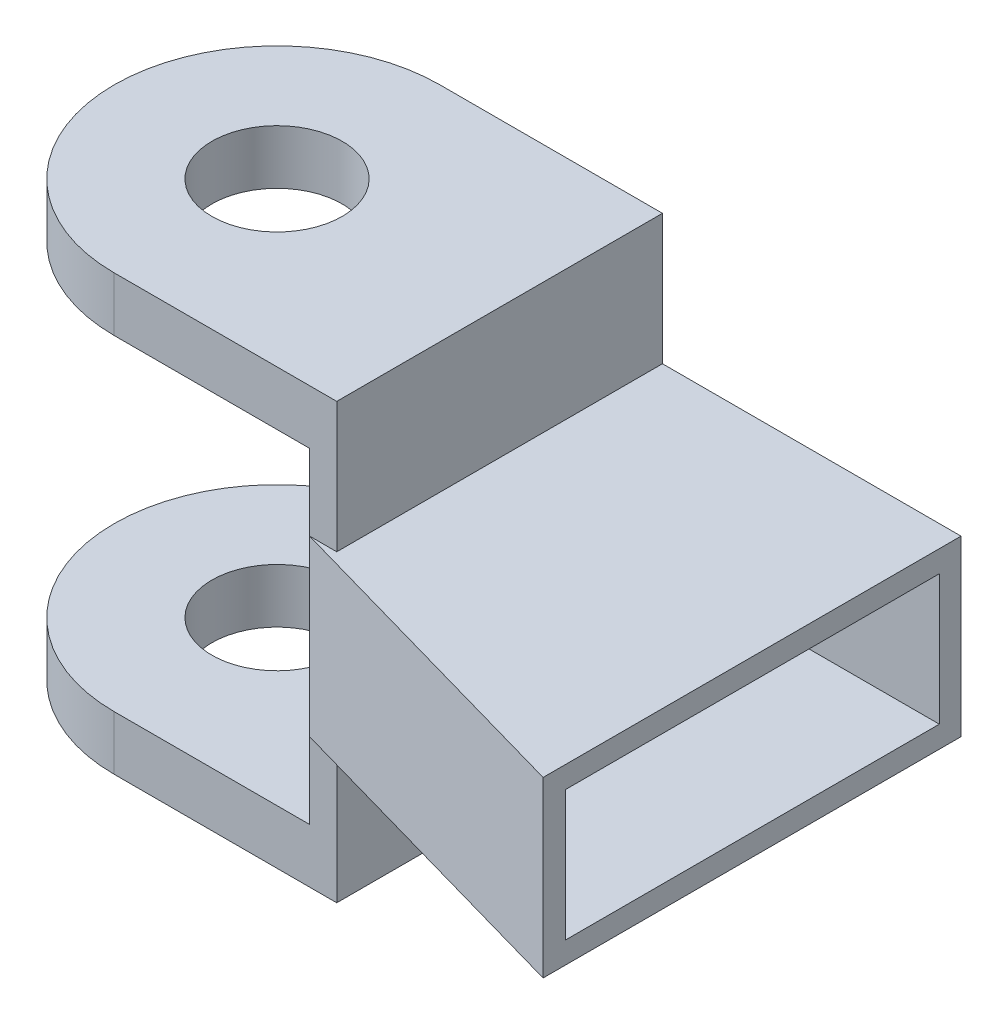
from build123d import *

# Parameters (mm, degrees)
BOSS_EXTRUDE1_DEPTH = 16
SHELL1_T            = -2
SKETCH2_R           = 6
BOSS_EXTRUDE2_DEPTH = 5
SKETCH4_W           = 30
SKETCH4_H           = 12
BOSS_EXTRUDE3_DEPTH = 2.5
SKETCH5_R           = 6
BOSS_EXTRUDE4_DEPTH = 5


with BuildPart() as part:
    # Sketch1 → Boss-Extrude1 (new body)
    with BuildSketch(Plane(origin=(0, 0, 0), x_dir=(1, 0, 0), z_dir=(0, 1, 0))):
        Polygon((-350, 31.008229654), (-320, 22.514402641), (-320, 61.008229654), (-350, 61.008229654), align=None)
    extrude(amount=BOSS_EXTRUDE1_DEPTH)

    # Shell1
    shell1_openings = [part.faces().sort_by_distance(p)[0] for p in [
        (-320, 8, -41.761316148),
    ]]
    offset(amount=SHELL1_T, openings=shell1_openings, kind=Kind.INTERSECTION)



with BuildPart() as body_2:
    # Sketch2 → Boss-Extrude2 (new body)
    with BuildSketch(Plane(origin=(0, 23, 0), x_dir=(1, 0, 0), z_dir=(0, 1, 0))):
        with BuildLine():
            Line((-350, 61.008229654), (-368, 61.008229654))
            ThreePointArc((-368, 61.008229654), (-383, 46.008229654), (-368, 31.008229654))
            Line((-368, 31.008229654), (-350, 31.008229654))
            Line((-350, 31.008229654), (-350, 61.008229654))
        make_face()
        with Locations(Location((-368, 46.008229654, 0), (0, 0, 270))):
            Circle(SKETCH2_R, mode=Mode.SUBTRACT)
    extrude(amount=BOSS_EXTRUDE2_DEPTH)


with BuildPart() as part_1:
    add(part.part)

    add(body_2.part)  # Boss-Extrude3 merges body 2
    # Sketch4 → Boss-Extrude3 (add)
    with BuildSketch(Plane.ZY.offset(350)):
        with Locations((-46.008229654, 22)):
            Rectangle(SKETCH4_W, SKETCH4_H)
    boss_extrude3 = extrude(amount=-BOSS_EXTRUDE3_DEPTH)

    # Mirror14: Boss-Extrude3 across plane
    add(boss_extrude3.mirror(Plane(origin=(0, 8, 0), x_dir=(0, 0, 1), z_dir=(0, -1, 0))))

    # Sketch5 → Boss-Extrude4 (add)
    with BuildSketch(Plane.XZ.offset(12)):
        with BuildLine():
            Line((-350, -61.008229654), (-350, -31.008229654))
            Line((-350, -31.008229654), (-368, -31.008229654))
            ThreePointArc((-368, -31.008229654), (-383, -46.008229654), (-368, -61.008229654))
            Line((-368, -61.008229654), (-350, -61.008229654))
        make_face()
        with Locations(Location((-368, -46.008229654, 0), (0, 0, 90))):
            Circle(SKETCH5_R, mode=Mode.SUBTRACT)
    extrude(amount=-BOSS_EXTRUDE4_DEPTH)


solid = part_1.part
